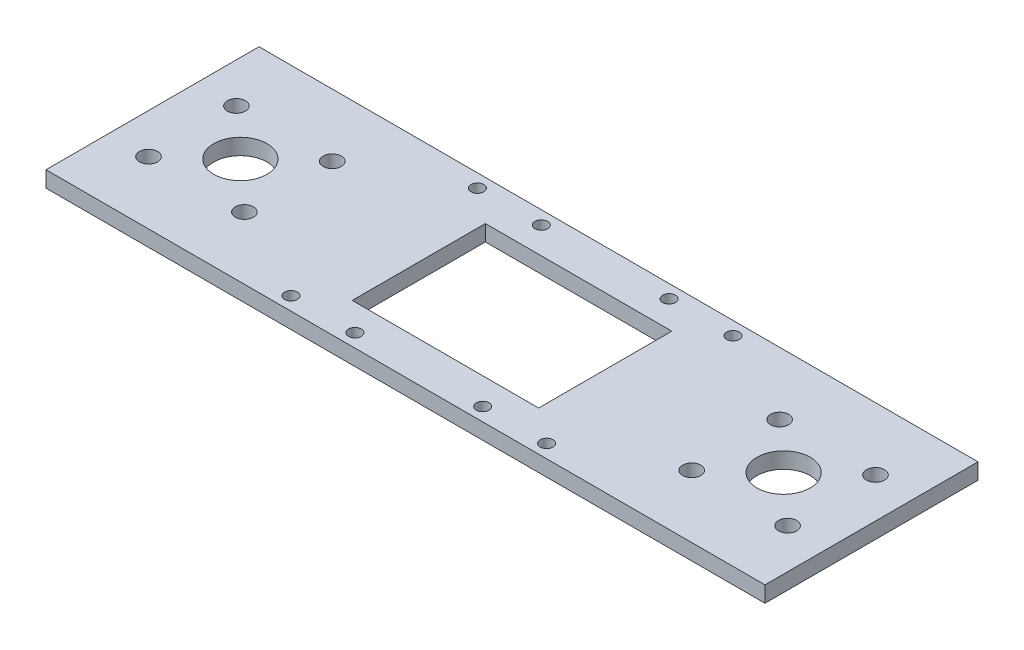
from build123d import *

# Parameters (mm, degrees)
SKETCH1_W           = 135
SKETCH1_H           = 40
SKETCH1_R           = 5
SKETCH1_R_2         = 1.7
SKETCH1_W_2         = 10
SKETCH1_H_2         = 20
BOSS_EXTRUDE1_DEPTH = 3
SKETCH3_R           = 1.2
CUT_EXTRUDE1_DEPTH  = 71.464530084
SKETCH4_W           = 35
SKETCH4_H           = 25
CUT_EXTRUDE2_DEPTH  = 71.464530084


with BuildPart() as part:
    # Sketch1 → Boss-Extrude1 (new body)
    with BuildSketch(Plane(origin=(0, 0, 0), x_dir=(1, 0, 0), z_dir=(0, 1, 0))):
        Rectangle(SKETCH1_W, SKETCH1_H)
        with Locations(Location((-51, 0, 0), (0, 0, 270))):
            Circle(SKETCH1_R, mode=Mode.SUBTRACT)
        with Locations(Location((-60, 8.25, 0), (0, 0, 270))):
            Circle(SKETCH1_R_2, mode=Mode.SUBTRACT)
        with Locations(Location((-42, 8.25, 0), (0, 0, 270))):
            Circle(SKETCH1_R_2, mode=Mode.SUBTRACT)
        with Locations(Location((-42, -8.25, 0), (0, 0, 270))):
            Circle(SKETCH1_R_2, mode=Mode.SUBTRACT)
        with Locations(Location((-60, -8.25, 0), (0, 0, 270))):
            Circle(SKETCH1_R_2, mode=Mode.SUBTRACT)
        with Locations(Location((51, 0, 0), (0, 0, 90))):
            Circle(SKETCH1_R, mode=Mode.SUBTRACT)
        with Locations(Location((42, 8.25, 0), (0, 0, 90))):
            Circle(SKETCH1_R_2, mode=Mode.SUBTRACT)
        with Locations(Location((42, -8.25, 0), (0, 0, 90))):
            Circle(SKETCH1_R_2, mode=Mode.SUBTRACT)
        with Locations(Location((60, -8.25, 0), (0, 0, 90))):
            Circle(SKETCH1_R_2, mode=Mode.SUBTRACT)
        with Locations(Location((60, 8.25, 0), (0, 0, 90))):
            Circle(SKETCH1_R_2, mode=Mode.SUBTRACT)
        Rectangle(SKETCH1_W_2, SKETCH1_H_2, mode=Mode.SUBTRACT)
    extrude(amount=BOSS_EXTRUDE1_DEPTH)

    # Sketch3 → Cut-Extrude1 (cut, through all)
    with BuildSketch(Plane(origin=(0, 3, 0), x_dir=(1, 0, 0), z_dir=(0, 1, 0))):
        with Locations(Location((-12, 17.5, 0), (0, 0, 270))):
            Circle(SKETCH3_R)
        with Locations(Location((-12, -17.5, 0), (0, 0, 90))):
            Circle(SKETCH3_R)
        with Locations(Location((-24, 17.5, 0), (0, 0, 270))):
            Circle(SKETCH3_R)
        with Locations(Location((-24, -17.5, 0), (0, 0, 90))):
            Circle(SKETCH3_R)
        with Locations(Location((24, -17.5, 0), (0, 0, 270))):
            Circle(SKETCH3_R)
        with Locations(Location((24, 17.5, 0), (0, 0, 90))):
            Circle(SKETCH3_R)
        with Locations(Location((12, -17.5, 0), (0, 0, 270))):
            Circle(SKETCH3_R)
        with Locations(Location((12, 17.5, 0), (0, 0, 90))):
            Circle(SKETCH3_R)
    extrude(amount=-CUT_EXTRUDE1_DEPTH, mode=Mode.SUBTRACT)

    # Sketch4 → Cut-Extrude2 (cut, through all)
    with BuildSketch(Plane(origin=(0, 3, 0), x_dir=(1, 0, 0), z_dir=(0, 1, 0))):
        Rectangle(SKETCH4_W, SKETCH4_H)
    extrude(amount=-CUT_EXTRUDE2_DEPTH, mode=Mode.SUBTRACT)


solid = part.part
